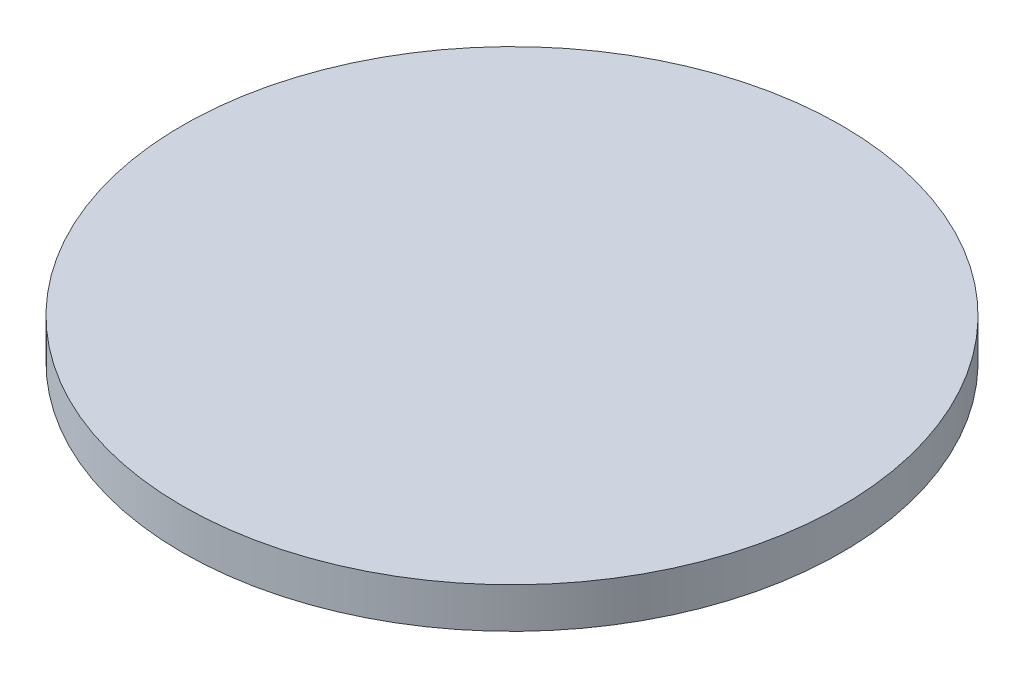
from build123d import *

# Parameters (mm, degrees)
SKETCH1_R           = 24.489877444
BOSS_EXTRUDE1_DEPTH = 3


with BuildPart() as part:
    # Sketch1 → Boss-Extrude1 (new body)
    with BuildSketch(Plane(origin=(0, 0, 0), x_dir=(1, 0, 0), z_dir=(0, 1, 0))):
        with Locations(Location((0, 0, 0), (0, 0, 270))):
            Circle(SKETCH1_R)
    extrude(amount=BOSS_EXTRUDE1_DEPTH)


solid = part.part
